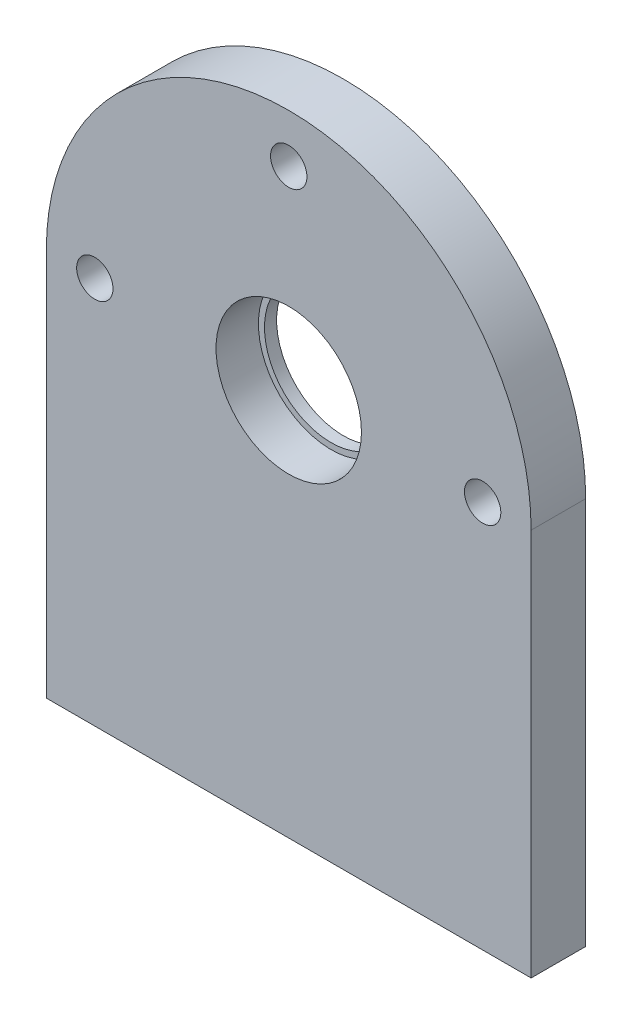
from build123d import *

# Parameters (mm, degrees)
SKETCH_1_R               = 6
EXTRUDE_1_DEPTH          = 4.5
SKETCH_3_R               = 6
SKETCH_3_R_2             = 5.5
EXTRUDE_2_DEPTH          = 1
CUT_EXTRUDE_3_DEPTH      = 39.003289331
CUT_EXTRUDE_3_DEPTH_BACK = 39.003289331
SKETCH_5_R               = 1.5
SKETCH_6_R               = 1.5
CUT_EXTRUDE_4_DEPTH      = 5


with BuildPart() as part:
    # 草图1 → 凸台-拉伸1 (new body)
    with BuildSketch(Plane.XY):
        with BuildLine():
            Line((-20, 0), (-20, -32))
            Line((-20, -32), (20, -32))
            Line((20, -32), (20, 0))
            ThreePointArc((20, 0), (0, 20), (-20, 0))
        make_face()
        Circle(SKETCH_1_R, mode=Mode.SUBTRACT)
    extrude(amount=EXTRUDE_1_DEPTH)

    # 草图3 → 凸台-拉伸2 (add)
    with BuildSketch(Plane.XY):
        Circle(SKETCH_3_R)
        Circle(SKETCH_3_R_2, mode=Mode.SUBTRACT)
    extrude(amount=EXTRUDE_2_DEPTH)

    # 草图5 → 切除-拉伸3 (cut, two sides: drawn at the far end of the back side and taken through both)
    with BuildSketch(Plane.XY.offset(-CUT_EXTRUDE_3_DEPTH_BACK)):
        with Locations((0, 16)):
            Circle(SKETCH_5_R)
        with Locations((-16, 0)):
            Circle(SKETCH_5_R)
        with Locations((16, 0)):
            Circle(SKETCH_5_R)
    extrude(amount=CUT_EXTRUDE_3_DEPTH + CUT_EXTRUDE_3_DEPTH_BACK, mode=Mode.SUBTRACT)

    # 草图6 → 切除-拉伸4 (cut)
    with BuildSketch(Plane.XZ.offset(32)):
        with Locations(Location((9, 2.25, 0), (0, 0, 270))):
            Circle(SKETCH_6_R)
        with Locations(Location((-9, 2.25, 0), (0, 0, 270))):
            Circle(SKETCH_6_R)
    extrude(amount=-CUT_EXTRUDE_4_DEPTH, mode=Mode.SUBTRACT)


solid = part.part
